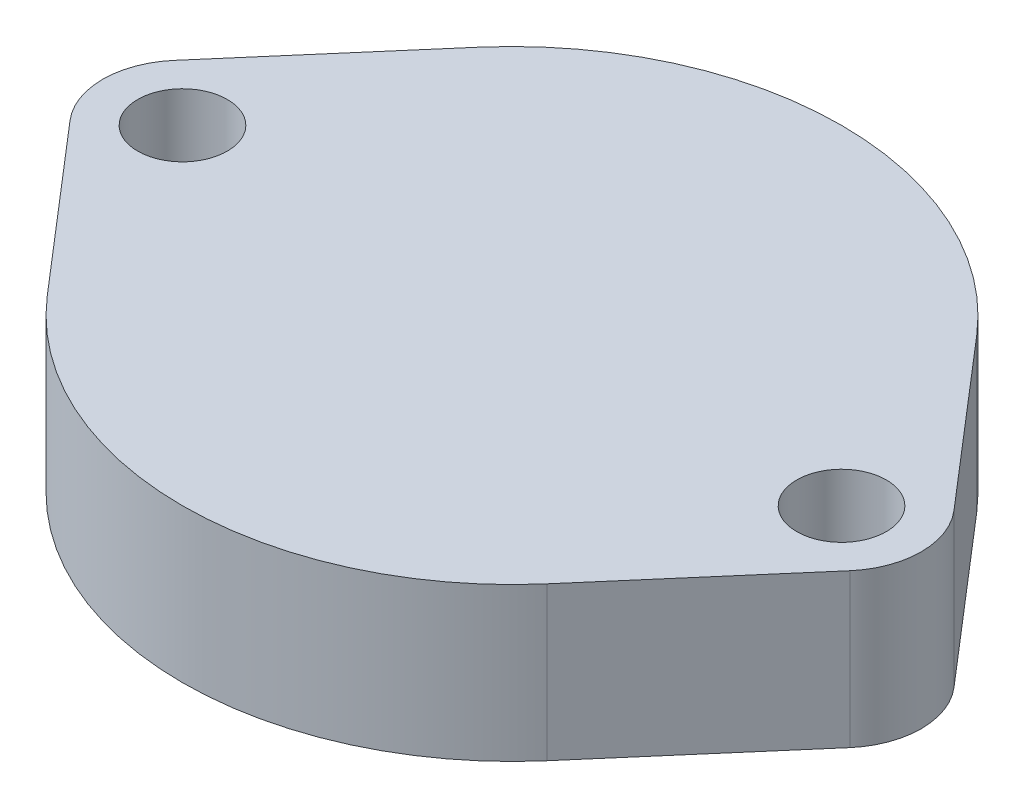
from build123d import *

# Parameters (mm, degrees)
SKETCH1_R           = 1.7272
BOSS_EXTRUDE1_DEPTH = 5.9055


with BuildPart() as part:
    # Sketch1 → Boss-Extrude1 (new body)
    with BuildSketch(Plane(origin=(0, 0, 0), x_dir=(1, 0, 0), z_dir=(0, 1, 0))):
        with BuildLine():
            Line((-15.0296372, 2.004639139), (-9.6266, 8.283632805))
            ThreePointArc((-9.6266, 8.283632805), (0, 12.7), (9.6266, 8.283632805))
            Line((9.6266, 8.283632805), (15.0296372, 2.004639139))
            ThreePointArc((15.0296372, 2.004639139), (15.7734, 0), (15.0296372, -2.004639139))
            Line((15.0296372, -2.004639139), (9.6266, -8.283632805))
            ThreePointArc((9.6266, -8.283632805), (0, -12.7), (-9.6266, -8.283632805))
            Line((-9.6266, -8.283632805), (-15.0296372, -2.004639139))
            ThreePointArc((-15.0296372, -2.004639139), (-15.7734, 0), (-15.0296372, 2.004639139))
        make_face()
        with Locations(Location((-12.7, 0, 0), (0, 0, 270))):
            Circle(SKETCH1_R, mode=Mode.SUBTRACT)
        with Locations(Location((12.7, 0, 0), (0, 0, 270))):
            Circle(SKETCH1_R, mode=Mode.SUBTRACT)
    extrude(amount=BOSS_EXTRUDE1_DEPTH)


solid = part.part
